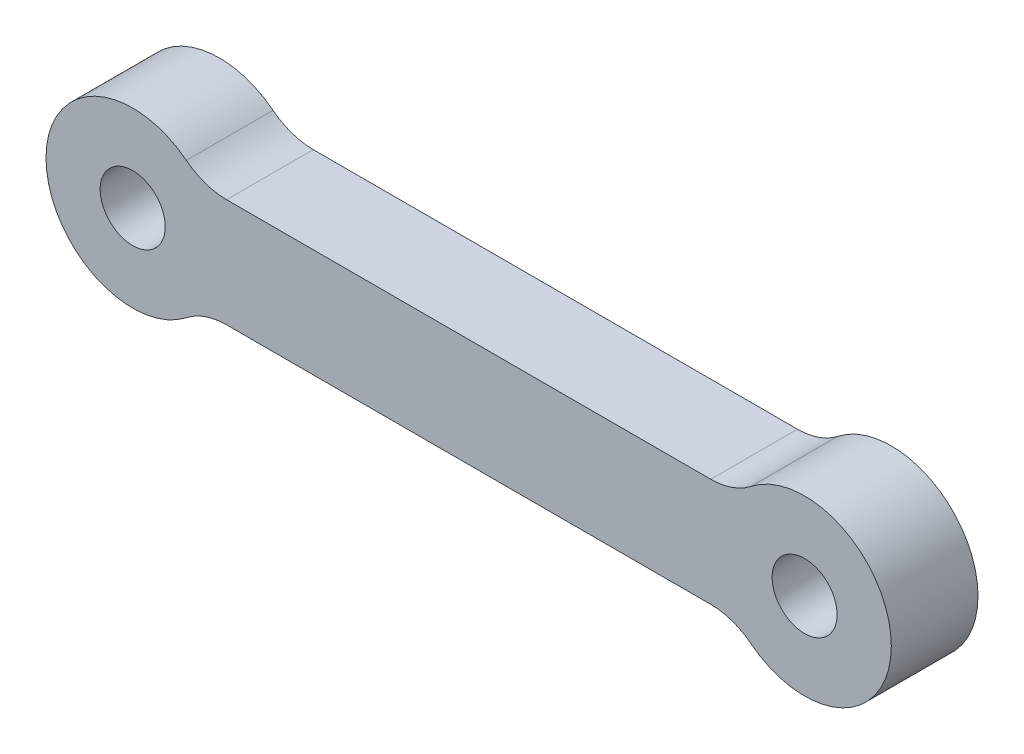
from build123d import *

# Parameters (mm, degrees)
SKETCH1_R           = 1.5
BOSS_EXTRUDE1_DEPTH = 4


with BuildPart() as part:
    # Sketch1 → Boss-Extrude1 (new body)
    with BuildSketch(Plane.XY):
        with BuildLine():
            Line((11.169872981, -2.5), (-11.169872981, -2.5))
            ThreePointArc((-11.169872981, -2.5), (-12.151853487, -2.665266452), (-13.025641703, -3.142857143))
            ThreePointArc((-13.025641703, -3.142857143), (-19.5, 0), (-13.025641703, 3.142857143))
            ThreePointArc((-13.025641703, 3.142857143), (-12.151853487, 2.665266452), (-11.169872981, 2.5))
            Line((-11.169872981, 2.5), (11.169872981, 2.5))
            ThreePointArc((11.169872981, 2.5), (12.151853487, 2.665266452), (13.025641703, 3.142857143))
            ThreePointArc((13.025641703, 3.142857143), (19.5, 0), (13.025641703, -3.142857143))
            ThreePointArc((13.025641703, -3.142857143), (12.151853487, -2.665266452), (11.169872981, -2.5))
        make_face()
        with Locations((-15.5, 0)):
            Circle(SKETCH1_R, mode=Mode.SUBTRACT)
        with Locations(Location((15.5, 0, 0), (0, 0, 180))):
            Circle(SKETCH1_R, mode=Mode.SUBTRACT)
    extrude(amount=BOSS_EXTRUDE1_DEPTH)


solid = part.part
